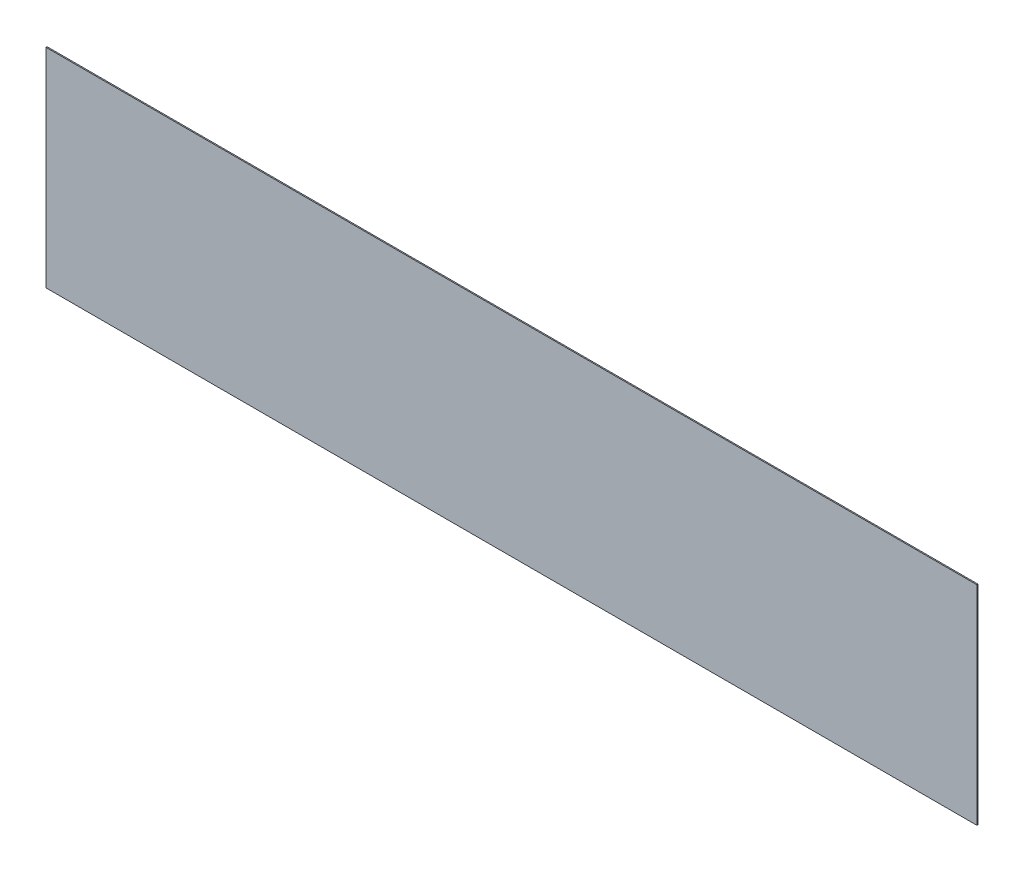
from build123d import *

# Parameters (mm, degrees)
SKETCH1_W           = 2667
SKETCH1_H           = 596.9
BOSS_EXTRUDE1_DEPTH = 3.175


with BuildPart() as part:
    # Sketch1 → Boss-Extrude1 (new body)
    with BuildSketch(Plane.XY):
        Rectangle(SKETCH1_W, SKETCH1_H)
    extrude(amount=BOSS_EXTRUDE1_DEPTH)


solid = part.part
